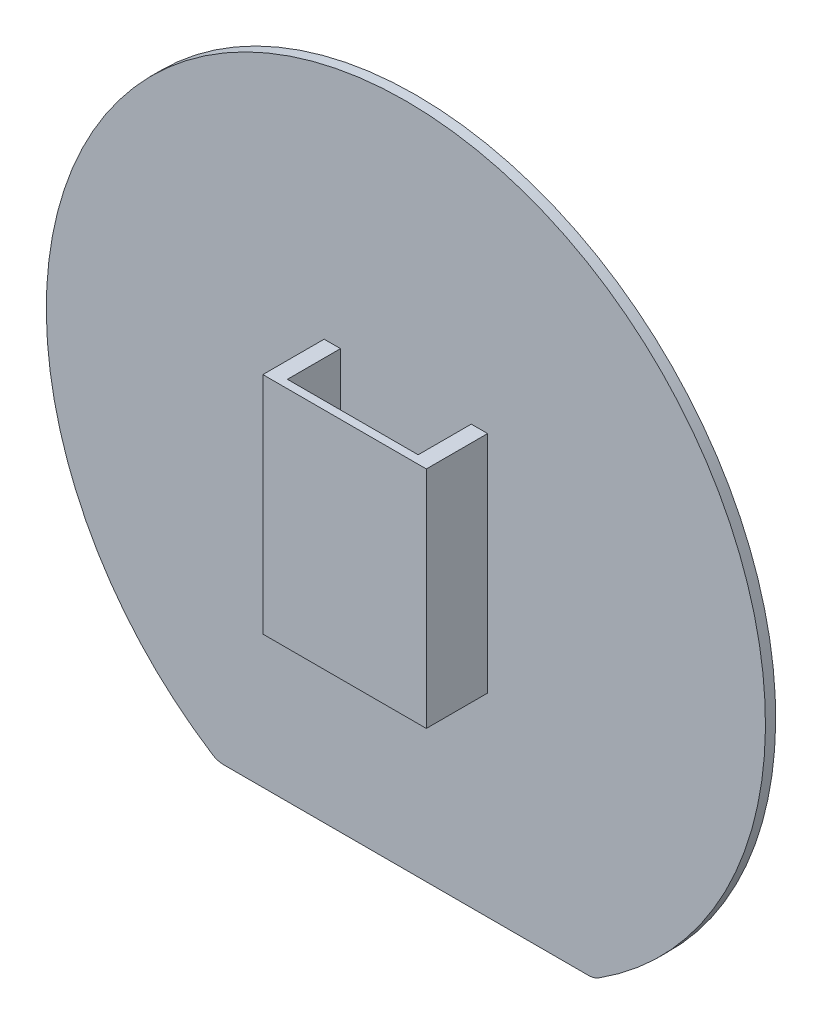
from build123d import *

# Parameters (mm, degrees)
BOSS_EXTRUDE1_DEPTH = 2.5
SKETCH2_W           = 40
SKETCH2_H           = 55
BOSS_EXTRUDE2_DEPTH = 15
SKETCH3_W           = 32
SKETCH3_H           = 13
CUT_EXTRUDE1_DEPTH  = 146.976881731
FILLET1_R           = 5


with BuildPart() as part:
    # Sketch1 → Boss-Extrude1 (new body)
    with BuildSketch(Plane.XY):
        with BuildLine():
            ThreePointArc((88, 0), (-42.971685161, 76.794754212), (-46.032597146, -75))
            Line((-46.032597146, -75), (46.032597146, -75))
            ThreePointArc((46.032597146, -75), (76.794754212, -42.971685161), (88, 0))
        make_face()
    extrude(amount=-BOSS_EXTRUDE1_DEPTH)

    # Sketch2 → Boss-Extrude2 (add)
    with BuildSketch(Plane.XY):
        Rectangle(SKETCH2_W, SKETCH2_H)
    extrude(amount=BOSS_EXTRUDE2_DEPTH)

    # Sketch3 → Cut-Extrude1 (cut, through all)
    with BuildSketch(Plane.XZ.offset(27.5)):
        with Locations((0, 6.5)):
            Rectangle(SKETCH3_W, SKETCH3_H)
    extrude(amount=-CUT_EXTRUDE1_DEPTH, mode=Mode.SUBTRACT)

    # Fillet1
    fillet1_edges = [part.edges().sort_by_distance(p)[0] for p in [
        (-46.032597146, -75, -1.25),
        (46.032597146, -75, -1.25),
    ]]
    fillet(fillet1_edges, radius=FILLET1_R)


solid = part.part
